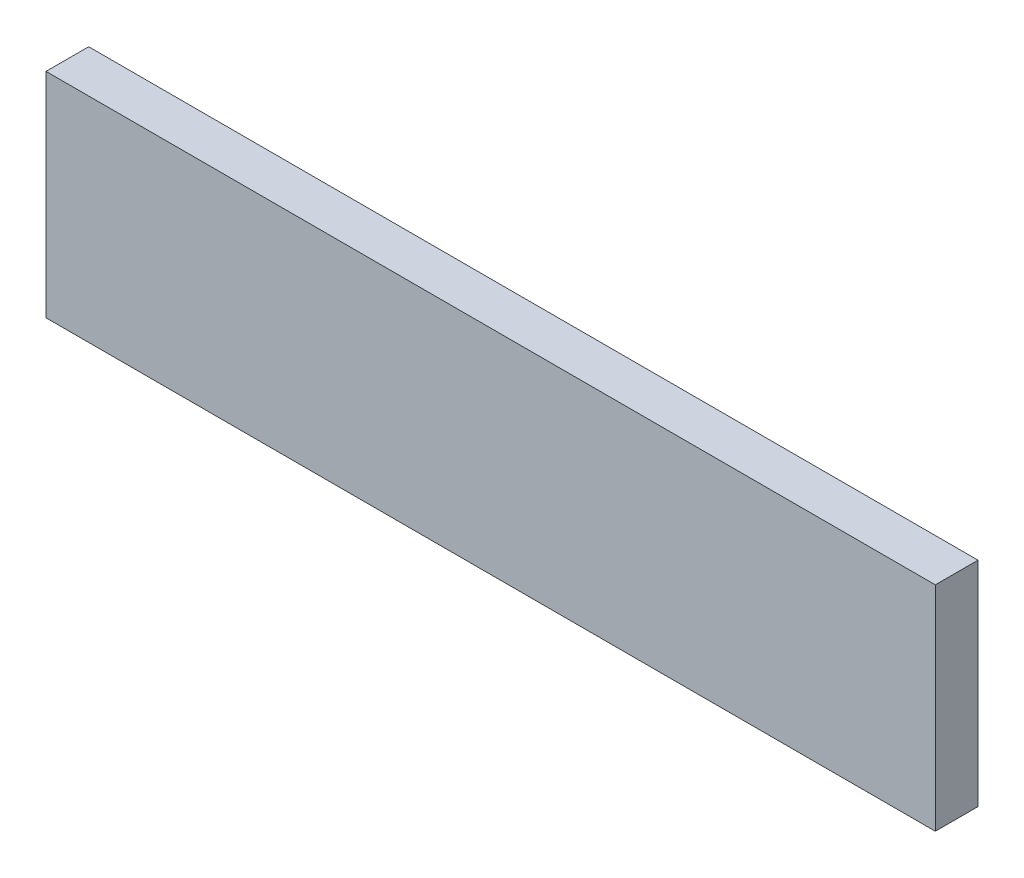
from build123d import *

# Parameters (mm, degrees)
CROQUIS1_W              = 25
CROQUIS1_H              = 6
SALIENTE_EXTRUIR1_DEPTH = 1.2


with BuildPart() as part:
    # Croquis1 → Saliente-Extruir1 (new body)
    with BuildSketch(Plane.XY):
        with Locations((-29.255319149, 9.854609929)):
            Rectangle(CROQUIS1_W, CROQUIS1_H)
    extrude(amount=SALIENTE_EXTRUIR1_DEPTH)


solid = part.part
